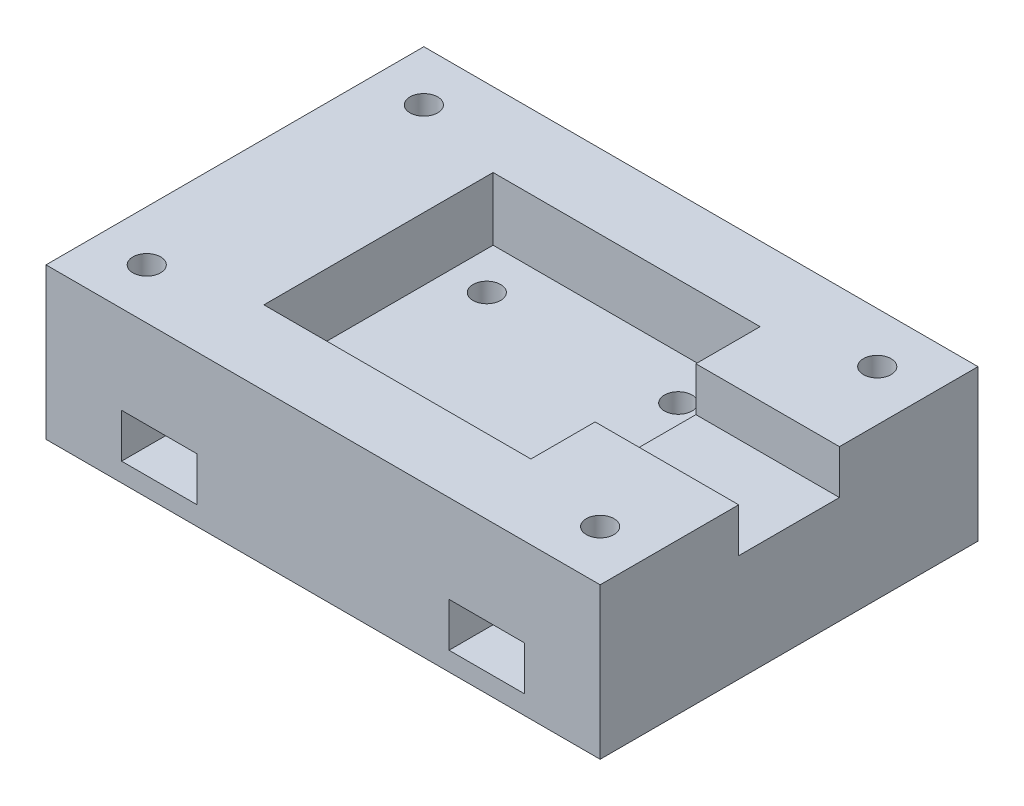
from build123d import *

# Parameters (mm, degrees)
SKETCH1_W               = 44
SKETCH1_H               = 30
POD_BODY_DEPTH          = 12
SKETCH2_W               = 21.2
SKETCH2_H               = 18.2
BOARD_POCKET_DEPTH      = 5
SKETCH3_R               = 1.1
BOARD_PILOT_HOLES_DEPTH = 9
SKETCH4_R               = 1.1
LID_PILOT_HOLES_DEPTH   = 8
SKETCH5_W               = 12.65
SKETCH5_H               = 8
CABLE_EXIT_DEPTH        = 3.5
STRAP_SLOTS_DEPTH       = 30.206163733
STRAP_SLOTS_DEPTH_BACK  = 30.206163733
SKETCH7_W               = 6
SKETCH7_H               = 3.5


with BuildPart() as part:
    # Sketch1 → Pod Body (new body)
    with BuildSketch(Plane(origin=(0, 0, 0), x_dir=(1, 0, 0), z_dir=(0, 1, 0))):
        Rectangle(SKETCH1_W, SKETCH1_H)
    extrude(amount=POD_BODY_DEPTH)

    # Sketch2 → Board Pocket (cut)
    with BuildSketch(Plane(origin=(0, 12, 0), x_dir=(1, 0, 0), z_dir=(0, 1, 0))):
        Rectangle(SKETCH2_W, SKETCH2_H)
    extrude(amount=-BOARD_POCKET_DEPTH, mode=Mode.SUBTRACT)

    # Sketch3 → Board Pilot Holes (cut)
    with BuildSketch(Plane(origin=(0, 12, 0), x_dir=(1, 0, 0), z_dir=(0, 1, 0))):
        with Locations(Location((-7.6, 5.6, 0), (0, 0, 270))):
            Circle(SKETCH3_R)
        with Locations(Location((7.6, 5.6, 0), (0, 0, 270))):
            Circle(SKETCH3_R)
    extrude(amount=-BOARD_PILOT_HOLES_DEPTH, mode=Mode.SUBTRACT)

    # Sketch4 → Lid Pilot Holes (cut)
    with BuildSketch(Plane(origin=(0, 12, 0), x_dir=(1, 0, 0), z_dir=(0, 1, 0))):
        with Locations(Location((-18, -11, 0), (0, 0, 270))):
            Circle(SKETCH4_R)
        with Locations(Location((-18, 11, 0), (0, 0, 270))):
            Circle(SKETCH4_R)
        with Locations(Location((18, -11, 0), (0, 0, 270))):
            Circle(SKETCH4_R)
        with Locations(Location((18, 11, 0), (0, 0, 270))):
            Circle(SKETCH4_R)
    extrude(amount=-LID_PILOT_HOLES_DEPTH, mode=Mode.SUBTRACT)

    # Sketch5 → Cable Exit (cut)
    with BuildSketch(Plane(origin=(0, 12, 0), x_dir=(1, 0, 0), z_dir=(0, 1, 0))):
        with Locations((16.675, 0)):
            Rectangle(SKETCH5_W, SKETCH5_H)
    extrude(amount=-CABLE_EXIT_DEPTH, mode=Mode.SUBTRACT)

    # Sketch7 → Strap Slots (cut, two sides: drawn at the far end of the back side and taken through both)
    with BuildSketch(Plane.XY.offset(-STRAP_SLOTS_DEPTH_BACK)):
        with Locations((-13, 3.25)):
            Rectangle(SKETCH7_W, SKETCH7_H)
        with Locations((13, 3.25)):
            Rectangle(SKETCH7_W, SKETCH7_H)
    extrude(amount=STRAP_SLOTS_DEPTH + STRAP_SLOTS_DEPTH_BACK, mode=Mode.SUBTRACT)


solid = part.part
